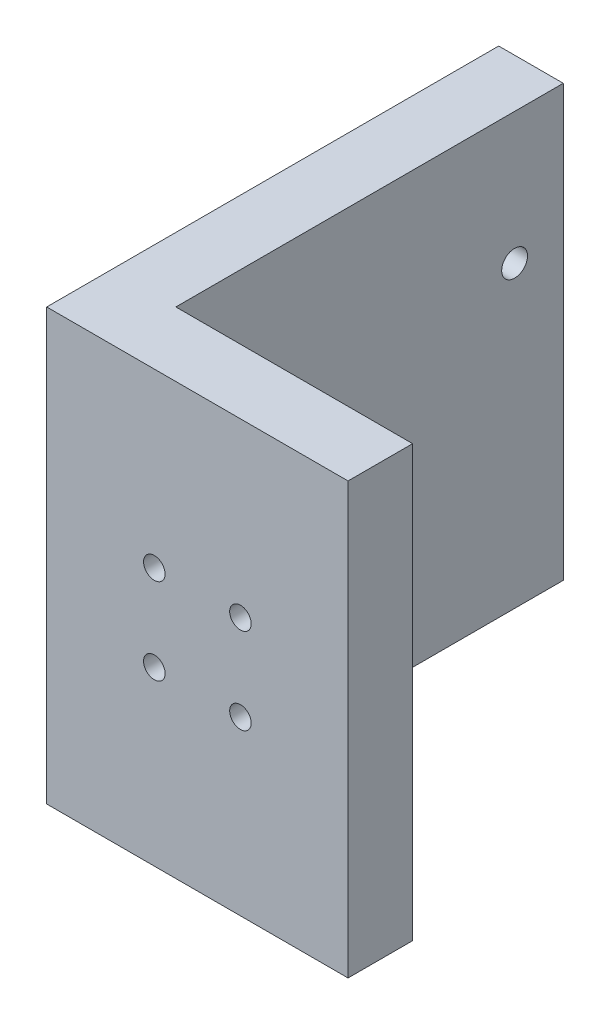
from build123d import *

# Parameters (mm, degrees)
BOSS_EXTRU_1_DEPTH      = 50
ESQUISSE2_R             = 1.25
ENL_V_MAT_EXTRU_1_DEPTH = 37.5
ESQUISSE3_R             = 1.5
ENL_V_MAT_EXTRU_2_DEPTH = 13.5


with BuildPart() as part:
    # Esquisse1 → Boss.-Extru.1 (new body)
    with BuildSketch(Plane(origin=(0, 0, 0), x_dir=(1, 0, 0), z_dir=(0, 1, 0))):
        Polygon((0, 0), (35, 0), (35, 7.5), (7.5, 7.5), (7.5, 52.5), (0, 52.5), align=None)
    extrude(amount=BOSS_EXTRU_1_DEPTH)

    # Esquisse2 → Enlèv. mat.-Extru.1 (cut)
    with BuildSketch(Plane.XY):
        with Locations((22.5, 30)):
            Circle(ESQUISSE2_R)
        with Locations((22.5, 20)):
            Circle(ESQUISSE2_R)
        with Locations((12.5, 20)):
            Circle(ESQUISSE2_R)
        with Locations((12.5, 30)):
            Circle(ESQUISSE2_R)
    extrude(amount=-ENL_V_MAT_EXTRU_1_DEPTH, mode=Mode.SUBTRACT)

    # Esquisse3 → Enlèv. mat.-Extru.2 (cut)
    with BuildSketch(Plane.ZY.offset(-7.5)):
        with Locations(Location((-30, 5.55, 0), (0, 0, 180))):
            Circle(ESQUISSE3_R)
        with Locations((-46.844194104, 34.725)):
            Circle(ESQUISSE3_R)
        with Locations((-13.155805896, 34.725)):
            Circle(ESQUISSE3_R)
    extrude(amount=ENL_V_MAT_EXTRU_2_DEPTH, mode=Mode.SUBTRACT)


solid = part.part
